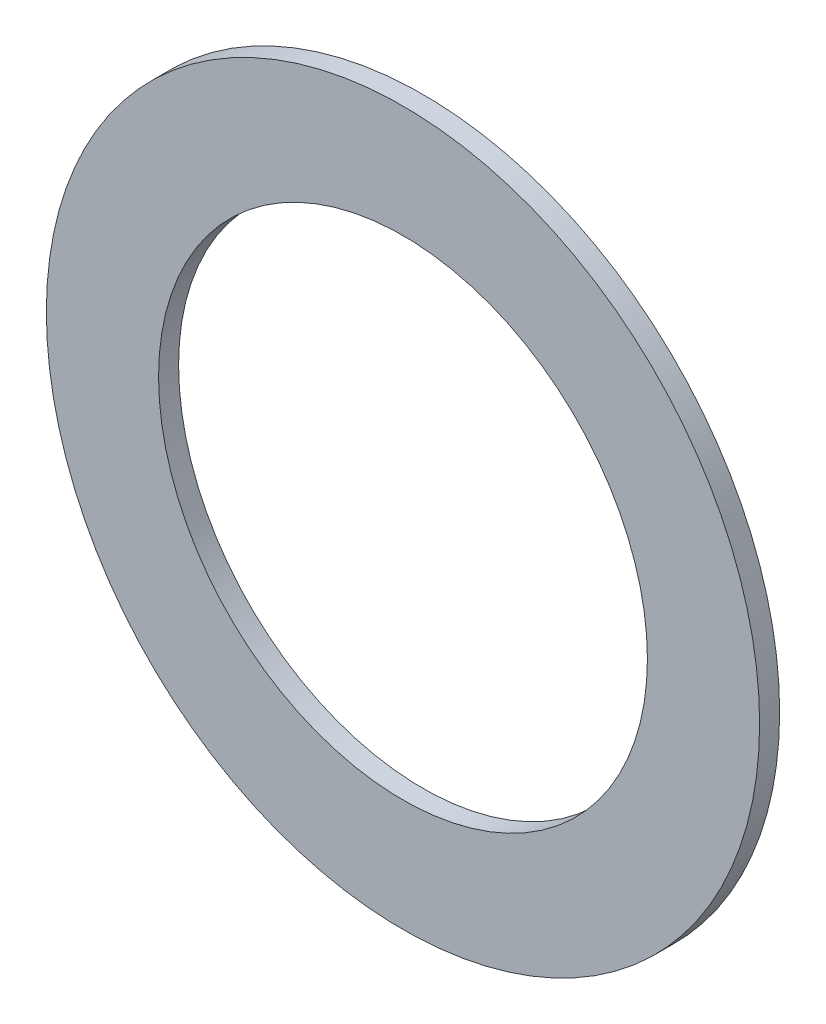
from build123d import *

# Parameters (mm, degrees)
ESQUISSE1_R      = 8.9
ESQUISSE1_R_2    = 6.1
EXTRUSION1_DEPTH = 0.5


with BuildPart() as part:
    # Esquisse1 → Extrusion1 (new body)
    with BuildSketch(Plane.XY):
        Circle(ESQUISSE1_R)
        Circle(ESQUISSE1_R_2, mode=Mode.SUBTRACT)
    extrude(amount=EXTRUSION1_DEPTH)


solid = part.part
